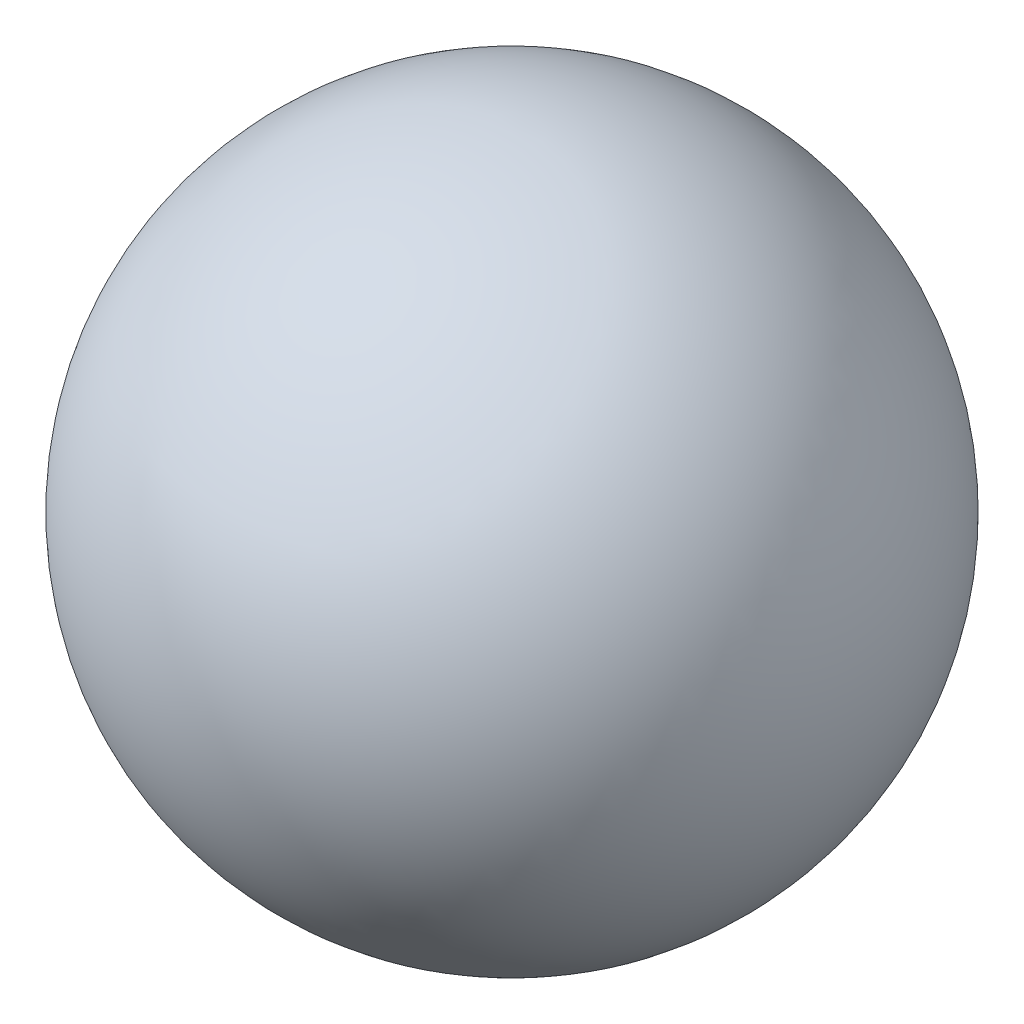
from build123d import *


with BuildPart() as part:
    # Sketch1 → Revolve1 (revolve)
    with BuildSketch(Plane(origin=(0, 0, 0), x_dir=(0, 0, -1), z_dir=(1, 0, 0))):
        with BuildLine():
            Line((0, 11.15), (0, -11.15))
            ThreePointArc((0, -11.15), (11.15, 0), (0, 11.15))
        make_face()
    revolve(axis=Axis((0, 11.15, 0), (0, -1, 0)))


solid = part.part
